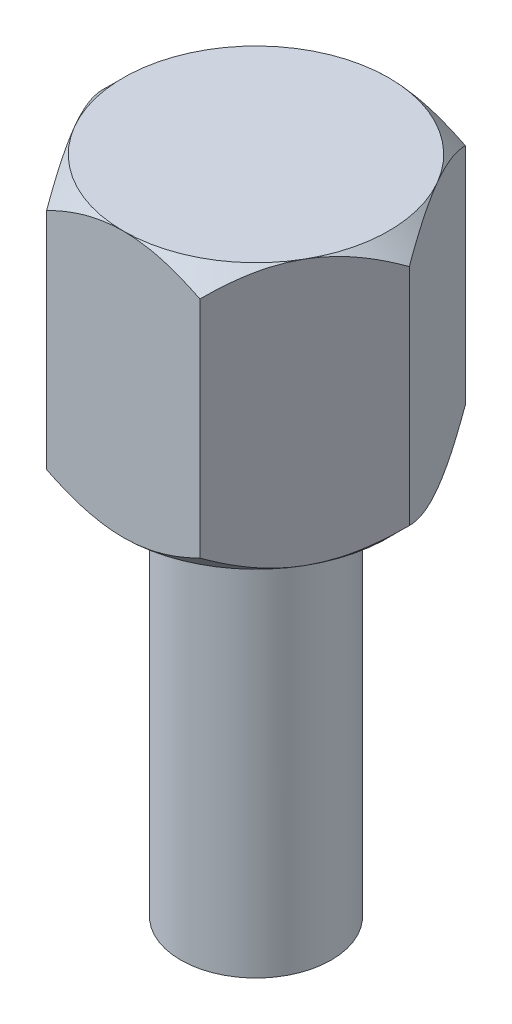
from build123d import *

# Parameters (mm, degrees)
BOSS_EXTRUDE1_DEPTH = 4.699
SKETCH2_R           = 1.3335
BOSS_EXTRUDE2_DEPTH = 6.985


with BuildPart() as part:
    # Sketch1 → Boss-Extrude1 (new body)
    with BuildSketch(Plane(origin=(0, 0, 0), x_dir=(1, 0, 0), z_dir=(0, 1, 0))):
        Polygon((2.712968915, 0), (1.356484457, 2.3495), (-1.356484457, 2.3495), (-2.712968915, 0), (-1.356484457, -2.3495), (1.356484457, -2.3495), align=None)
    extrude(amount=BOSS_EXTRUDE1_DEPTH)

    # Sketch2 → Boss-Extrude2 (add)
    with BuildSketch(Plane.XZ):
        with Locations(Location((0, 0, 0), (0, 0, 90))):
            Circle(SKETCH2_R)
    extrude(amount=BOSS_EXTRUDE2_DEPTH)

    # Sketch5 → Cut-Revolve1 (revolve, cut)
    with BuildSketch(Plane(origin=(0, 0, 0), x_dir=(0, 0, -1), z_dir=(1, 0, 0))):
        Polygon((2.3495, 4.699), (3.223173217, 3.825326783), (3.223173217, 4.699), align=None)
    cut_revolve1 = revolve(axis=Axis((0, 4.699, 0), (0, 1, 0)), mode=Mode.SUBTRACT)

    # Mirror1: Cut-Revolve1 across plane
    add(cut_revolve1.mirror(Plane.ZX.offset(2.3495)), mode=Mode.SUBTRACT)


solid = part.part
